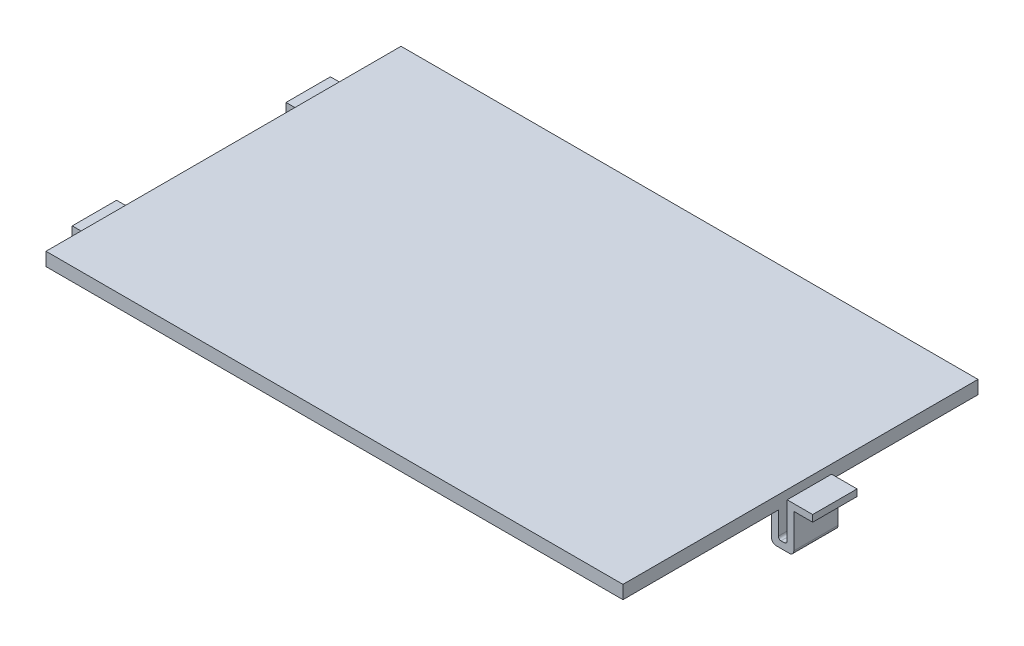
from build123d import *

# Parameters (mm, degrees)
SKETCH1_W                = 130
SKETCH1_H                = 80
BOSS_EXTRUDE1_DEPTH      = 3
BOSS_EXTRUDE2_DEPTH      = 5
BOSS_EXTRUDE2_DEPTH_BACK = 5
SKETCH3_W                = 4
SKETCH3_H                = 10
BOSS_EXTRUDE3_DEPTH      = 2
SKETCH4_W                = 10
SKETCH4_H                = 2
BOSS_EXTRUDE4_DEPTH      = 5


with BuildPart() as part:
    # Sketch1 → Boss-Extrude1 (new body)
    with BuildSketch(Plane(origin=(0, 0, 0), x_dir=(1, 0, 0), z_dir=(0, 1, 0))):
        Rectangle(SKETCH1_W, SKETCH1_H)
    extrude(amount=BOSS_EXTRUDE1_DEPTH)

    # Sketch2 → Boss-Extrude2 (add, two sides: drawn at the far end of the back side and taken through both)
    with BuildSketch(Plane.XY.offset(-BOSS_EXTRUDE2_DEPTH_BACK)):
        with BuildLine():
            Line((63.5, 1.5), (63.5, -6.205455333))
            ThreePointArc((63.5, -6.205455333), (63.792893219, -6.912562114), (64.5, -7.205455333))
            Line((64.5, -7.205455333), (67.5, -7.205455333))
            ThreePointArc((67.5, -7.205455333), (68.207106781, -6.912562114), (68.5, -6.205455333))
            Line((68.5, -6.205455333), (68.5, 1.5))
            Line((68.5, 1.5), (72.74730308, 1.5))
            Line((72.74730308, 1.5), (72.74730308, 3))
            Line((72.74730308, 3), (67, 3))
            Line((67, 3), (67, -5.105455333))
            ThreePointArc((67, -5.105455333), (66.824264069, -5.529719402), (66.4, -5.705455333))
            Line((66.4, -5.705455333), (65.6, -5.705455333))
            ThreePointArc((65.6, -5.705455333), (65.175735931, -5.529719402), (65, -5.105455333))
            Line((65, -5.105455333), (65, 1.5))
            Line((65, 1.5), (63.5, 1.5))
        make_face()
    extrude(amount=BOSS_EXTRUDE2_DEPTH + BOSS_EXTRUDE2_DEPTH_BACK)

    # Sketch3 → Boss-Extrude3 (add)
    with BuildSketch(Plane.XZ):
        with Locations((-63, 24.089900089)):
            Rectangle(SKETCH3_W, SKETCH3_H)
        with Locations((-63, -24.089900089)):
            Rectangle(SKETCH3_W, SKETCH3_H)
    extrude(amount=BOSS_EXTRUDE3_DEPTH)

    # Sketch4 → Boss-Extrude4 (add)
    with BuildSketch(Plane.ZY.offset(65)):
        with Locations((-24.089900089, -1)):
            Rectangle(SKETCH4_W, SKETCH4_H)
        with Locations((24.089900089, -1)):
            Rectangle(SKETCH4_W, SKETCH4_H)
    extrude(amount=BOSS_EXTRUDE4_DEPTH)


solid = part.part
